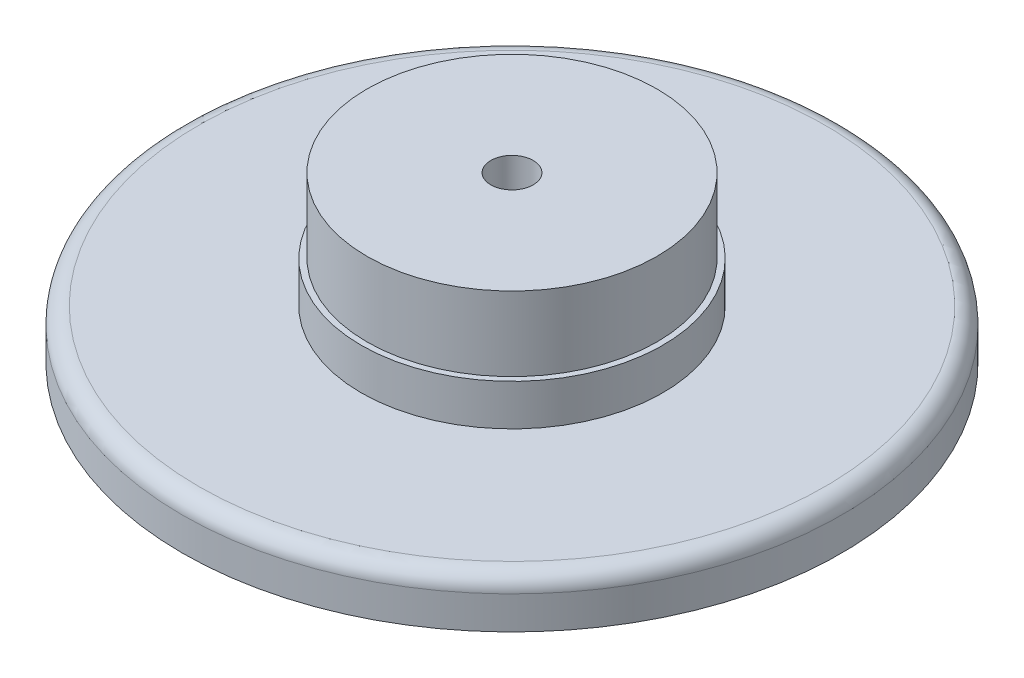
from build123d import *

# Parameters (mm, degrees)
SKETCH1_R                                           = 50.8
SKETCH1_R_2                                         = 23.241
BOSS_EXTRUDE4_DEPTH                                 = 7.62
SKETCH1_6_R                                         = 23.241
SKETCH1_6_R_2                                       = 22.352
BOSS_EXTRUDE5_DEPTH                                 = 13.97
SKETCH1_7_R                                         = 22.352
BOSS_EXTRUDE6_DEPTH                                 = 25.4
CSK_FOR_1_4_FLAT_HEAD_MACHINE_SCREW_100_D           = 6.5278
CSK_FOR_1_4_FLAT_HEAD_MACHINE_SCREW_100_CSINK_D     = 12.8778
CSK_FOR_1_4_FLAT_HEAD_MACHINE_SCREW_100_CSINK_ANGLE = 100
FILLET3_R                                           = 2.54


with BuildPart() as part:
    # Sketch1 → Boss-Extrude4 (new body)
    with BuildSketch(Plane(origin=(0, 0, 0), x_dir=(1, 0, 0), z_dir=(0, 1, 0))):
        Circle(SKETCH1_R)
        Circle(SKETCH1_R_2, mode=Mode.SUBTRACT)
    extrude(amount=BOSS_EXTRUDE4_DEPTH)

    # Sketch1<6> → Boss-Extrude5 (add)
    with BuildSketch(Plane(origin=(0, 0, 0), x_dir=(1, 0, 0), z_dir=(0, 1, 0))):
        Circle(SKETCH1_6_R)
        Circle(SKETCH1_6_R_2, mode=Mode.SUBTRACT)
    extrude(amount=BOSS_EXTRUDE5_DEPTH)

    # Sketch1<7> → Boss-Extrude6 (add)
    with BuildSketch(Plane(origin=(0, 0, 0), x_dir=(1, 0, 0), z_dir=(0, 1, 0))):
        Circle(SKETCH1_7_R)
    extrude(amount=BOSS_EXTRUDE6_DEPTH)

    # CSK for 1/4 Flat Head Machine Screw (100)1 (through all)
    with Locations(Plane(origin=(0, 0, 0), x_dir=(-1, 0, 0), z_dir=(0, -1, 0))):
        with Locations((0, 0)):
            CounterSinkHole(CSK_FOR_1_4_FLAT_HEAD_MACHINE_SCREW_100_D / 2, CSK_FOR_1_4_FLAT_HEAD_MACHINE_SCREW_100_CSINK_D / 2, counter_sink_angle=CSK_FOR_1_4_FLAT_HEAD_MACHINE_SCREW_100_CSINK_ANGLE)

    # Fillet3
    fillet3_edges = [part.edges().sort_by_distance(p)[0] for p in [
        (-50.8, 7.62, 0),
    ]]
    fillet(fillet3_edges, radius=FILLET3_R)


solid = part.part
